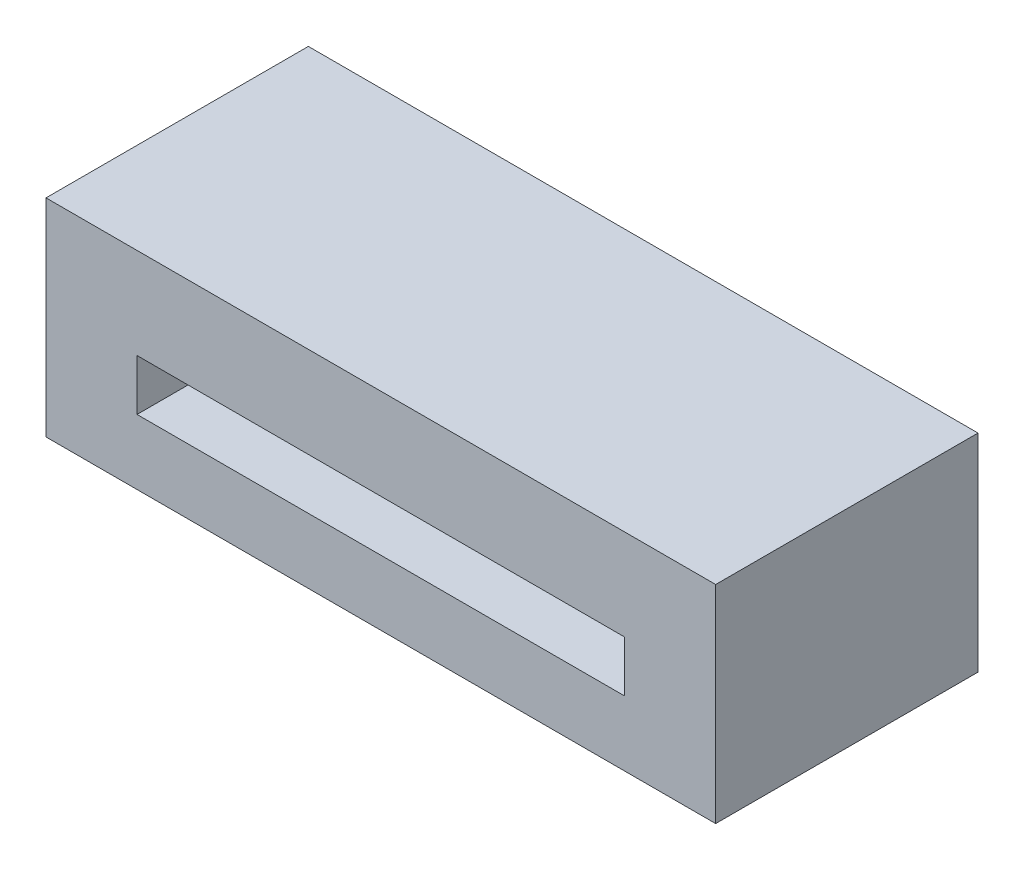
from build123d import *

# Parameters (mm, degrees)
ESQUISSE1_W             = 15
ESQUISSE1_H             = 8.07
BOSS_EXTRU_1_DEPTH      = 2.8
ESQUISSE4_W             = 2.8
ESQUISSE4_H             = 8.07
BOSS_EXTRU_3_DEPTH      = 6.37
BOSS_EXTRU_4_DEPTH      = 15
ESQUISSE6_W             = 2.5
ESQUISSE6_H             = 3.945
ENL_V_MAT_EXTRU_1_DEPTH = 3


with BuildPart() as part:
    # Esquisse1 → Boss.-Extru.1 (new body)
    with BuildSketch(Plane(origin=(0, 0, 0), x_dir=(1, 0, 0), z_dir=(0, 1, 0))):
        with Locations((7.5, 4.035)):
            Rectangle(ESQUISSE1_W, ESQUISSE1_H)
    extrude(amount=BOSS_EXTRU_1_DEPTH)

    # Esquisse4 → Boss.-Extru.3 (add)
    with BuildSketch(Plane(origin=(0, 2.8, 0), x_dir=(1, 0, 0), z_dir=(0, 1, 0))):
        with Locations((16.4, 4.035)):
            Rectangle(ESQUISSE4_W, ESQUISSE4_H)
        with Locations((-1.4, 4.035)):
            Rectangle(ESQUISSE4_W, ESQUISSE4_H)
    extrude(amount=-BOSS_EXTRU_3_DEPTH)

    # Esquisse5 → Boss.-Extru.4 (add)
    with BuildSketch(Plane(origin=(0, 0, 0), x_dir=(0, 0, -1), z_dir=(1, 0, 0))):
        Polygon((8.07, -3.57), (8.07, -1.57), (5.52241552, -1.57), (0, -1.57), (0, -3.57), align=None)
    extrude(amount=BOSS_EXTRU_4_DEPTH)

    # Esquisse6 → Enlèv. mat.-Extru.1 (cut)
    with BuildSketch(Plane.XZ.offset(3.57)):
        with Locations((7.655, -5.581368507)):
            Rectangle(ESQUISSE6_W, ESQUISSE6_H)
    extrude(amount=-ENL_V_MAT_EXTRU_1_DEPTH, mode=Mode.SUBTRACT)


solid = part.part
